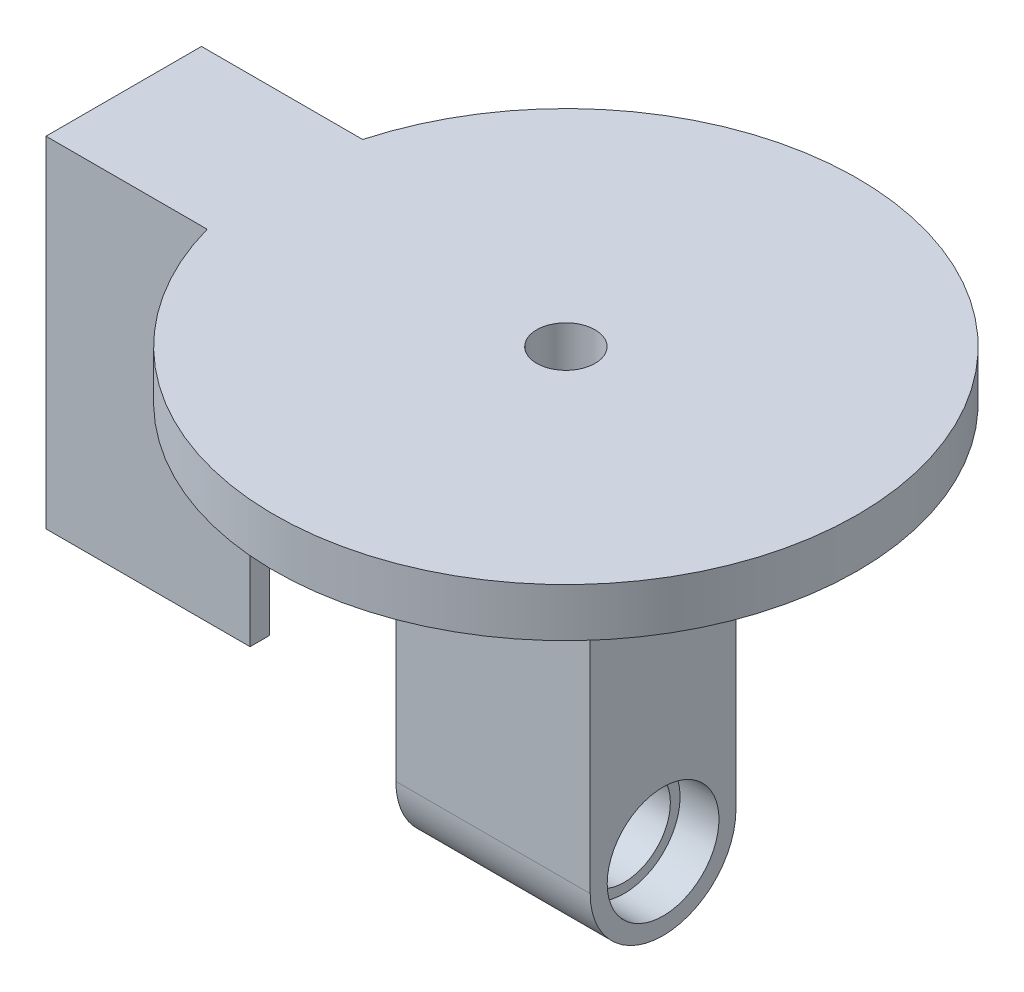
from build123d import *

# Parameters (mm, degrees)
SKETCH1_R                       = 30
BOSS_EXTRUDE1_DEPTH             = 5
SKETCH8_R                       = 4.75
BOSS_EXTRUDE3_DEPTH             = 10
SKETCH9_R                       = 5.75
CUT_EXTRUDE3_DEPTH              = 4
SKETCH16_W                      = 21
SKETCH16_H                      = 16
BOSS_EXTRUDE7_DEPTH             = 10
BOSS_EXTRUDE7_DIRECTION_2_REACH = 62.052
SKETCH17_W                      = 21
SKETCH17_H                      = 2
BOSS_EXTRUDE8_DEPTH             = 20
SKETCH18_R                      = 3
CUT_EXTRUDE4_DEPTH              = 8


with BuildPart() as part:
    # Sketch1 → Boss-Extrude1 (new body)
    with BuildSketch(Plane(origin=(0, 0, 0), x_dir=(1, 0, 0), z_dir=(0, 1, 0))):
        with Locations(Location((0, 0, 0), (0, 0, 270))):
            Circle(SKETCH1_R)
    extrude(amount=BOSS_EXTRUDE1_DEPTH)

    # Sketch8 → Boss-Extrude3 (add)
    with BuildSketch(Plane(origin=(10, 0, 0), x_dir=(0, 0, -1), z_dir=(1, 0, 0))):
        with BuildLine():
            Line((-7.5, 0), (-7.5, -35))
            ThreePointArc((-7.5, -35), (0, -42.5), (7.5, -35))
            Line((7.5, -35), (7.5, 0))
            Line((7.5, 0), (-7.5, 0))
        make_face()
        with Locations((0, -35)):
            Circle(SKETCH8_R, mode=Mode.SUBTRACT)
    boss_extrude3 = extrude(amount=-BOSS_EXTRUDE3_DEPTH)

    # Sketch9 → Cut-Extrude3 (cut)
    with BuildSketch(Plane.ZY.offset(-10)):
        with Locations((0, -35)):
            Circle(SKETCH9_R)
    cut_extrude3 = extrude(amount=CUT_EXTRUDE3_DEPTH, mode=Mode.SUBTRACT)

    # Mirror1: Boss-Extrude3, Cut-Extrude3 across plane
    add(boss_extrude3.mirror(Plane(origin=(0, 0, 0), x_dir=(0, 0, 1), z_dir=(1, 0, 0))))
    add(cut_extrude3.mirror(Plane(origin=(0, 0, 0), x_dir=(0, 0, 1), z_dir=(1, 0, 0))), mode=Mode.SUBTRACT)

    # Sketch16 → Boss-Extrude7 (add)
    with BuildSketch(Plane(origin=(0, 0, 0), x_dir=(-1, 0, 0), z_dir=(0, -1, 0))):
        with Locations((35, 0)):
            Rectangle(SKETCH16_W, SKETCH16_H)
    extrude(amount=BOSS_EXTRUDE7_DEPTH)

    # Boss-Extrude7 direction 2: up to this face of the body (flat: up to its plane)
    boss_extrude7_direction_2_end = Plane(part.part.faces().sort_by_distance((0, 5, 0))[0])
    # Sketch16 → Boss-Extrude7 direction 2 (add, up to the picked face)
    with BuildSketch(Plane(origin=(0, 0, 0), x_dir=(-1, 0, 0), z_dir=(0, -1, 0)), mode=Mode.PRIVATE) as boss_extrude7_direction_2_sk1:
        with Locations((35, 0)):
            Rectangle(SKETCH16_W, SKETCH16_H)
    boss_extrude7_direction_2_tool1 = split(extrude(boss_extrude7_direction_2_sk1.sketch, amount=-BOSS_EXTRUDE7_DIRECTION_2_REACH, mode=Mode.PRIVATE), bisect_by=boss_extrude7_direction_2_end, keep=Keep.BOTH, mode=Mode.PRIVATE)
    add(boss_extrude7_direction_2_tool1.solids().sort_by(Axis((-35, 0, 0), (0, 1, 0)))[0])

    # Sketch17 → Boss-Extrude8 (add)
    with BuildSketch(Plane.XZ.offset(10)):
        with Locations((-35, 7)):
            Rectangle(SKETCH17_W, SKETCH17_H)
        with Locations((-35, -7)):
            Rectangle(SKETCH17_W, SKETCH17_H)
    extrude(amount=BOSS_EXTRUDE8_DEPTH)

    # Sketch18 → Cut-Extrude4 (cut)
    with BuildSketch(Plane(origin=(0, 5, 0), x_dir=(1, 0, 0), z_dir=(0, 1, 0))):
        with Locations(Location((0, 0, 0), (0, 0, 270))):
            Circle(SKETCH18_R)
    extrude(amount=-CUT_EXTRUDE4_DEPTH, mode=Mode.SUBTRACT)


solid = part.part
